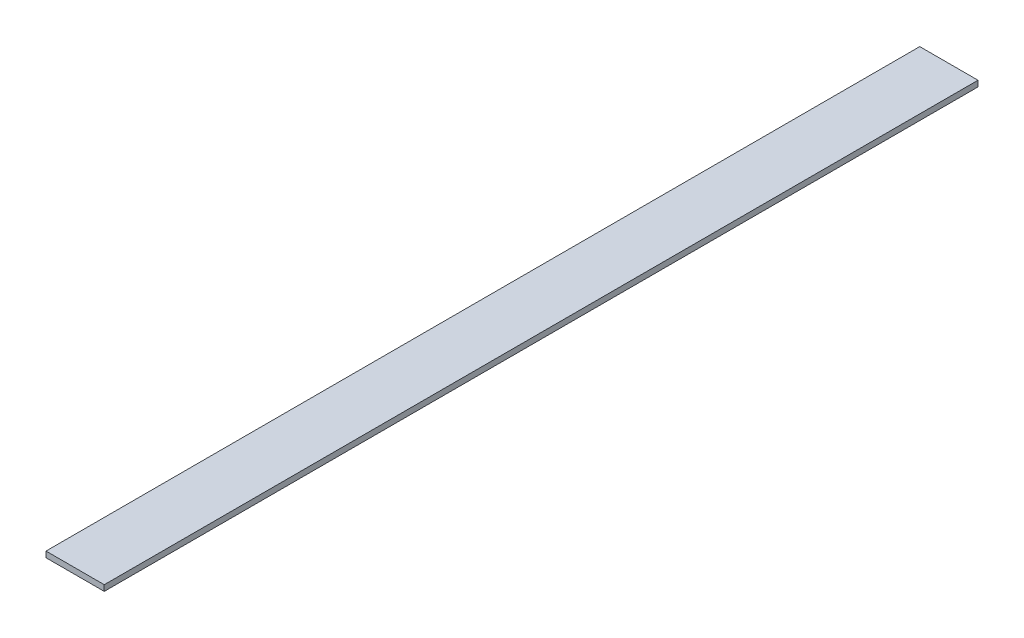
from build123d import *

# Parameters (mm, degrees)
SKETCH1_W           = 20
SKETCH1_H           = 2
BOSS_EXTRUDE1_DEPTH = 300


with BuildPart() as part:
    # Sketch1 → Boss-Extrude1 (new body)
    with BuildSketch(Plane.XY):
        with Locations((-19.865673593, 3.335339715)):
            Rectangle(SKETCH1_W, SKETCH1_H)
    extrude(amount=BOSS_EXTRUDE1_DEPTH)


solid = part.part
